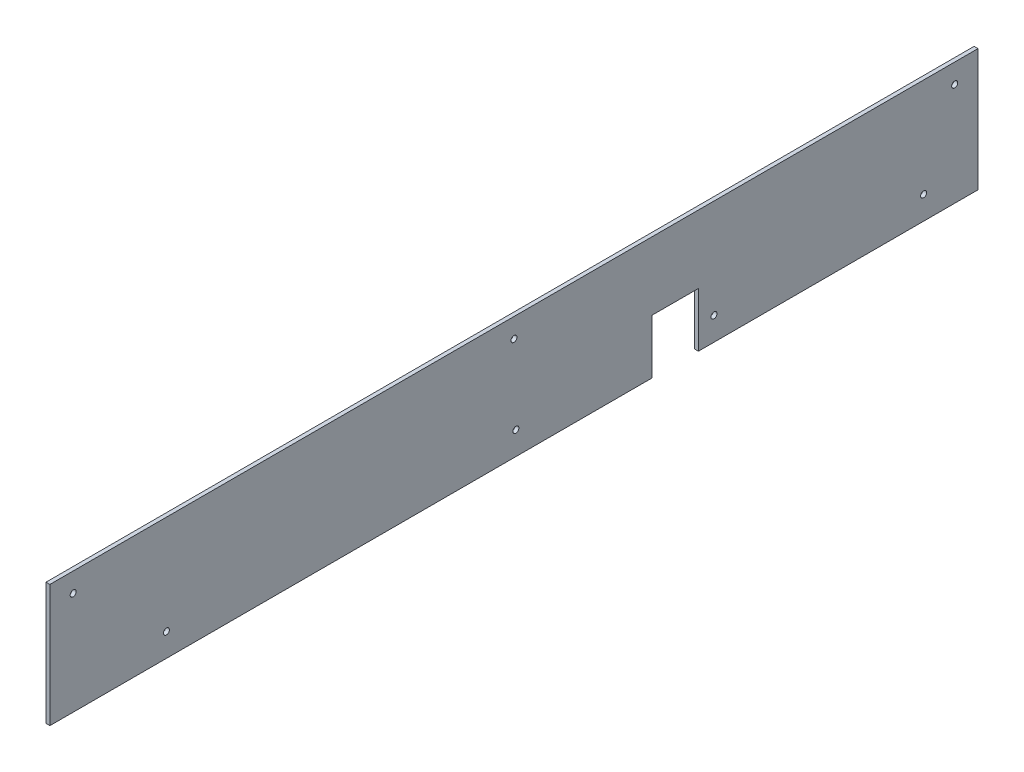
from build123d import *

# Parameters (mm, degrees)
SKETCH2_W                    = 758.825
SKETCH2_H                    = 100.0125
BOSS_EXTRUDE1_DEPTH          = 3.175
F_10_0_1935_DIAMETER_HOLE2_D = 4.9149
SKETCH7_W                    = 38.1
SKETCH7_H                    = 44.45
CUT_EXTRUDE3_DEPTH           = 254


with BuildPart() as part:
    # Sketch2 → Boss-Extrude1 (new body)
    with BuildSketch(Plane(origin=(0, 0, 0), x_dir=(0, 0, -1), z_dir=(1, 0, 0))):
        with Locations((379.4125, 50.00625)):
            Rectangle(SKETCH2_W, SKETCH2_H)
    extrude(amount=BOSS_EXTRUDE1_DEPTH)

    # #10 (0.1935) Diameter Hole2 (through all)
    with Locations(Plane(origin=(3.175, 0, 0), x_dir=(0, 0, -1), z_dir=(1, 0, 0))):
        with Locations((19.05, 84.1375), (379.4125, 84.1375), (739.775, 84.1375), (95.25, 19.05), (381, 19.05), (542.9885, 19.05), (714.375, 19.05)):
            Hole(F_10_0_1935_DIAMETER_HOLE2_D / 2)

    # Sketch7 → Cut-Extrude3 (cut)
    with BuildSketch(Plane(origin=(3.175, 0, 0), x_dir=(0, 0, -1), z_dir=(1, 0, 0))):
        with Locations((511.175, 22.225)):
            Rectangle(SKETCH7_W, SKETCH7_H)
    extrude(amount=-CUT_EXTRUDE3_DEPTH, mode=Mode.SUBTRACT)


solid = part.part
